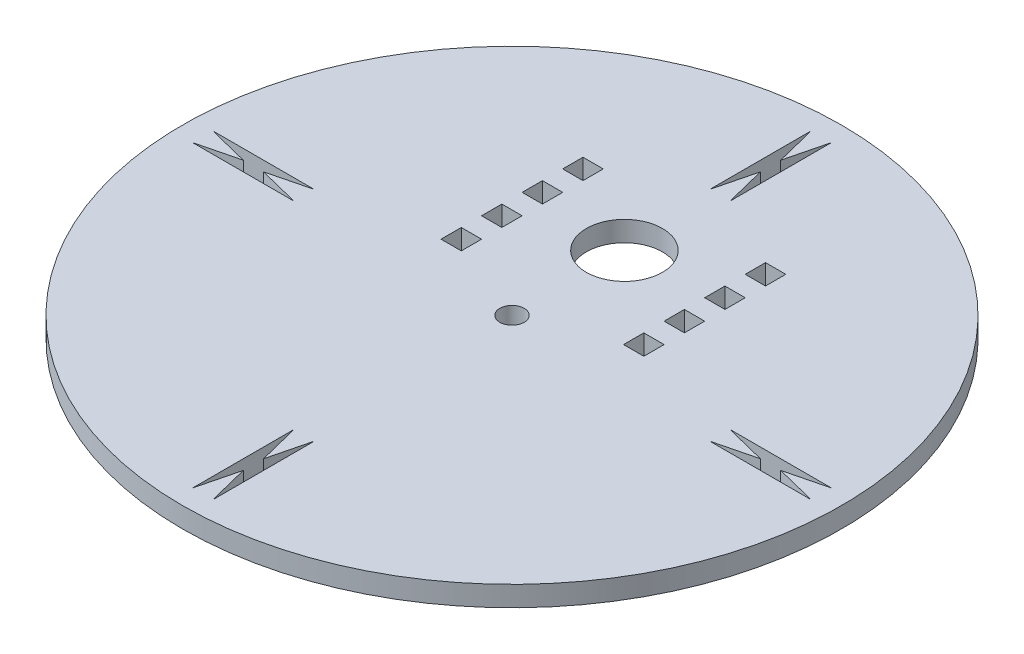
from build123d import *

# Parameters (mm, degrees)
SKETCH1_R           = 82.55
SKETCH1_R_2         = 3.048
SKETCH1_R_3         = 9.525
SKETCH1_W           = 5.08
SKETCH1_H           = 5.08
BOSS_EXTRUDE1_DEPTH = 5.08
CUT_EXTRUDE1_DEPTH  = 5.08


with BuildPart() as part:
    # Sketch1 → Boss-Extrude1 (new body)
    with BuildSketch(Plane(origin=(0, 0, 0), x_dir=(1, 0, 0), z_dir=(0, 1, 0))):
        with Locations(Location((-62.967414891, 81.40064069, 0), (0, 0, 270))):
            Circle(SKETCH1_R)
        with Locations(Location((-62.967414891, 81.40064069, 0), (0, 0, 270))):
            Circle(SKETCH1_R_2, mode=Mode.SUBTRACT)
        with Locations(Location((-62.967414891, 109.55654069, 0), (0, 0, 270))):
            Circle(SKETCH1_R_3, mode=Mode.SUBTRACT)
        with Locations((-85.827414891, 111.88064069)):
            Rectangle(SKETCH1_W, SKETCH1_H, mode=Mode.SUBTRACT)
        with Locations((-85.827414891, 91.56064069)):
            Rectangle(SKETCH1_W, SKETCH1_H, mode=Mode.SUBTRACT)
        with Locations((-85.827414891, 101.72064069)):
            Rectangle(SKETCH1_W, SKETCH1_H, mode=Mode.SUBTRACT)
        with Locations((-85.827414891, 122.04064069)):
            Rectangle(SKETCH1_W, SKETCH1_H, mode=Mode.SUBTRACT)
        with Locations((-40.107414891, 122.04064069)):
            Rectangle(SKETCH1_W, SKETCH1_H, mode=Mode.SUBTRACT)
        with Locations((-40.107414891, 111.88064069)):
            Rectangle(SKETCH1_W, SKETCH1_H, mode=Mode.SUBTRACT)
        with Locations((-40.107414891, 101.72064069)):
            Rectangle(SKETCH1_W, SKETCH1_H, mode=Mode.SUBTRACT)
        with Locations((-40.107414891, 91.56064069)):
            Rectangle(SKETCH1_W, SKETCH1_H, mode=Mode.SUBTRACT)
    extrude(amount=BOSS_EXTRUDE1_DEPTH)

    # Sketch2 → Cut-Extrude1 (cut)
    with BuildSketch(Plane(origin=(0, 5.08, 0), x_dir=(1, 0, 0), z_dir=(0, 1, 0))):
        Polygon((-62.967414891, 148.71064069), (-60.427414891, 158.87064069), (-60.427414891, 133.47064069), (-62.967414891, 143.63064069), (-65.507414891, 133.47064069), (-65.507414891, 158.87064069), align=None)
        Polygon((4.342585109, 81.40064069), (14.502585109, 78.86064069), (-10.897414891, 78.86064069), (-0.737414891, 81.40064069), (-10.897414891, 83.94064069), (14.502585109, 83.94064069), align=None)
        Polygon((-62.967414891, 14.09064069), (-65.507414891, 3.93064069), (-65.507414891, 29.33064069), (-62.967414891, 19.17064069), (-60.427414891, 29.33064069), (-60.427414891, 3.93064069), align=None)
        Polygon((-130.277414891, 81.40064069), (-140.437414891, 83.94064069), (-115.037414891, 83.94064069), (-125.197414891, 81.40064069), (-115.037414891, 78.86064069), (-140.437414891, 78.86064069), align=None)
    extrude(amount=-CUT_EXTRUDE1_DEPTH, mode=Mode.SUBTRACT)


solid = part.part
